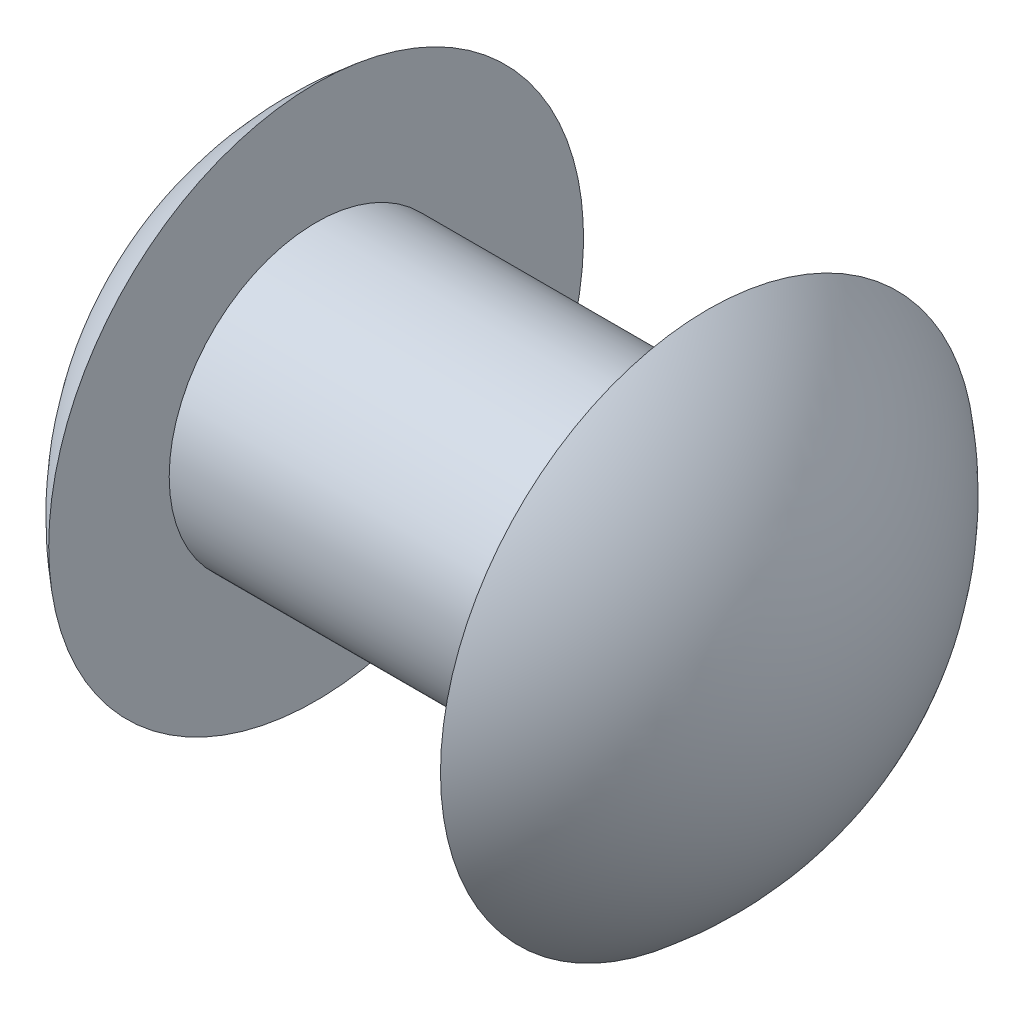
from build123d import *


with BuildPart() as part:
    # Эскиз1 → Повернуть1 (revolve)
    with BuildSketch(Plane.XY):
        with BuildLine():
            Line((-0.017667155, 1.5), (-0.017667155, 2.730271717))
            ThreePointArc((-0.017667155, 2.730271717), (-0.983297624, 1.514164206), (-1.327777579, 0))
            Line((-1.327777579, 0), (5.29244327, 0))
            ThreePointArc((5.29244327, 0), (4.947963315, 1.514164206), (3.982332845, 2.730271717))
            Line((3.982332845, 2.730271717), (3.982332845, 1.5))
            Line((3.982332845, 1.5), (-0.017667155, 1.5))
        make_face()
    revolve(axis=Axis((-49.423517382, 0, 0), (1, 0, 0)))


solid = part.part
